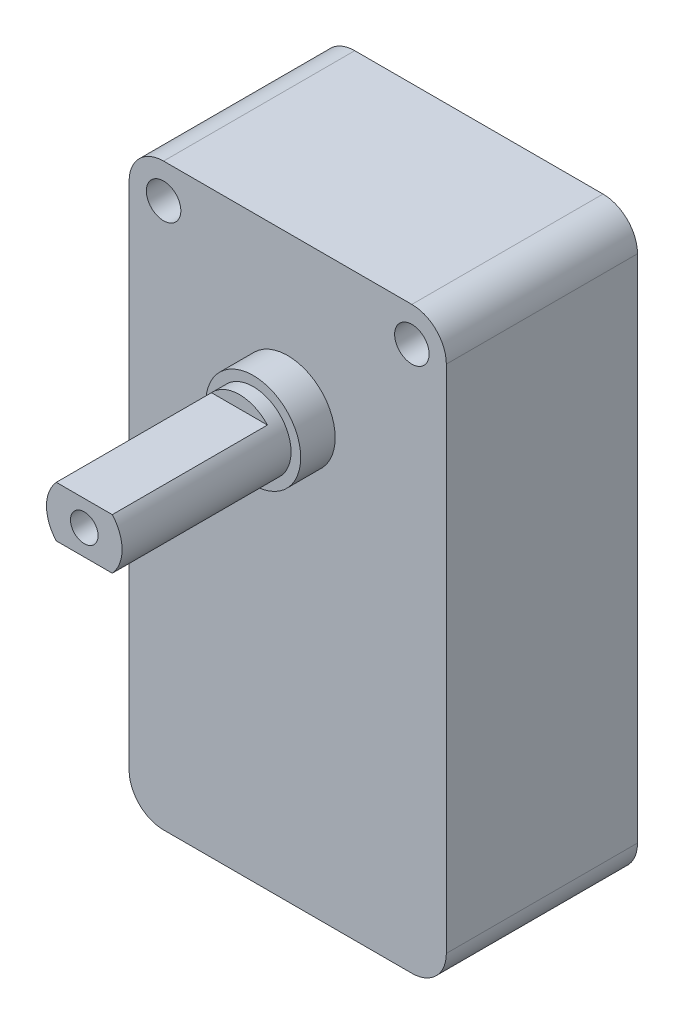
from build123d import *

# Parameters (mm, degrees)
SKETCH1_R           = 1.25
BOSS_EXTRUDE1_DEPTH = 13.86
SKETCH1_3_R         = 3.44
BOSS_EXTRUDE2_DEPTH = 2.5
SKETCH1_4_R         = 2.74
BOSS_EXTRUDE3_DEPTH = 3.5
SKETCH1_5_R         = 1
BOSS_EXTRUDE4_DEPTH = 14.75


with BuildPart() as part:
    # Sketch1 → Boss-Extrude1 (new body)
    with BuildSketch(Plane.XY):
        with BuildLine():
            Line((9, 11.15), (-9, 11.15))
            ThreePointArc((-9, 11.15), (-10.767766953, 10.417766953), (-11.5, 8.65))
            Line((-11.5, 8.65), (-11.5, -28.35))
            ThreePointArc((-11.5, -28.35), (-10.767766953, -30.117766953), (-9, -30.85))
            Line((-9, -30.85), (9, -30.85))
            ThreePointArc((9, -30.85), (10.767766953, -30.117766953), (11.5, -28.35))
            Line((11.5, -28.35), (11.5, 8.65))
            ThreePointArc((11.5, 8.65), (10.767766953, 10.417766953), (9, 11.15))
        make_face()
        with Locations((-9, 8.65)):
            Circle(SKETCH1_R, mode=Mode.SUBTRACT)
        with Locations((9, 8.65)):
            Circle(SKETCH1_R, mode=Mode.SUBTRACT)
    extrude(amount=-BOSS_EXTRUDE1_DEPTH)

    # Sketch1<3> → Boss-Extrude2 (add)
    with BuildSketch(Plane.XY):
        Circle(SKETCH1_3_R)
    extrude(amount=BOSS_EXTRUDE2_DEPTH)

    # Sketch1<4> → Boss-Extrude3 (add)
    with BuildSketch(Plane.XY):
        Circle(SKETCH1_4_R)
    extrude(amount=BOSS_EXTRUDE3_DEPTH)

    # Sketch1<5> → Boss-Extrude4 (add)
    with BuildSketch(Plane.XY):
        with BuildLine():
            ThreePointArc((2.74, 0), (2.556417641, 0.986067362), (2.030270918, 1.84))
            Line((2.030270918, 1.84), (-2.030270918, 1.84))
            ThreePointArc((-2.030270918, 1.84), (-2.74, 0), (-2.030270918, -1.84))
            Line((-2.030270918, -1.84), (2.030270918, -1.84))
            ThreePointArc((2.030270918, -1.84), (2.556417641, -0.986067362), (2.74, 0))
        make_face()
        Circle(SKETCH1_5_R, mode=Mode.SUBTRACT)
    extrude(amount=BOSS_EXTRUDE4_DEPTH)


solid = part.part
